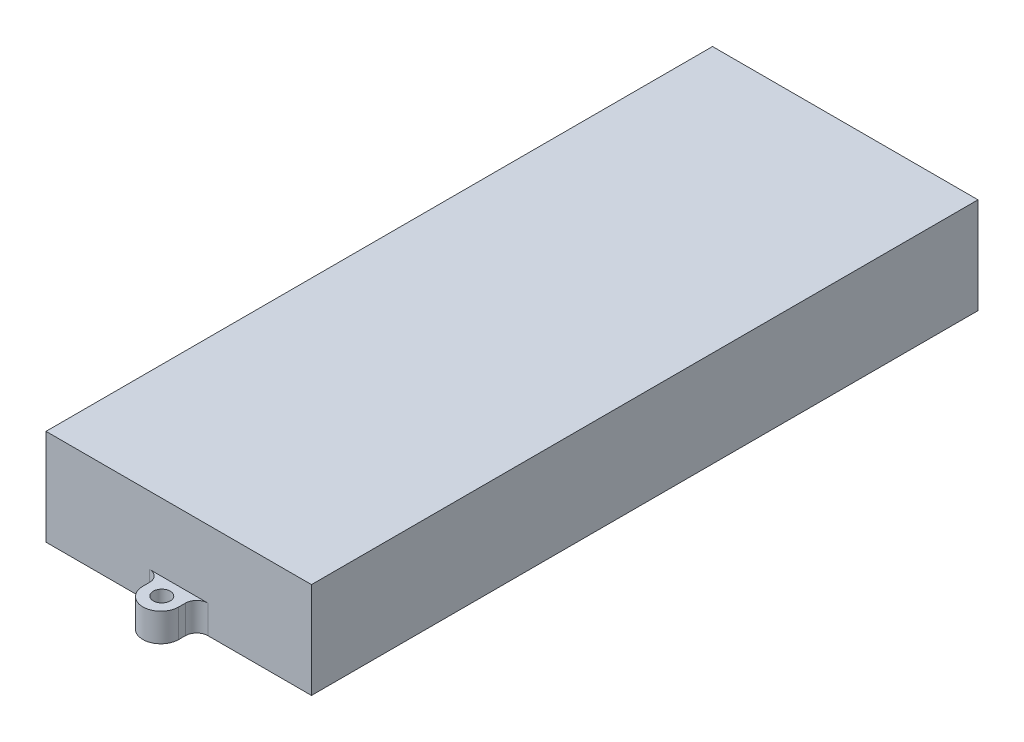
from build123d import *

# Parameters (mm, degrees)
SKETCH1_W           = 47
SKETCH1_H           = 118
BOSS_EXTRUDE1_DEPTH = 17
BOSS_EXTRUDE2_DEPTH = 5
SKETCH3_R           = 1.5
CUT_EXTRUDE1_DEPTH  = 71.476042028
FILLET2_R           = 2


with BuildPart() as part:
    # Sketch1 → Boss-Extrude1 (new body)
    with BuildSketch(Plane(origin=(0, 0, 0), x_dir=(1, 0, 0), z_dir=(0, 1, 0))):
        Rectangle(SKETCH1_W, SKETCH1_H)
    extrude(amount=BOSS_EXTRUDE1_DEPTH)

    # Sketch2 → Boss-Extrude2 (add)
    with BuildSketch(Plane(origin=(0, 0, 0), x_dir=(1, 0, 0), z_dir=(0, 1, 0))):
        with BuildLine():
            Line((-3.175, 62.175), (-3.175, 59))
            Line((-3.175, 59), (3.175, 59))
            Line((3.175, 59), (3.175, 62.175))
            ThreePointArc((3.175, 62.175), (0, 65.35), (-3.175, 62.175))
        make_face()
        with BuildLine():
            Line((3.175, -62.175), (3.175, -59))
            Line((3.175, -59), (-3.175, -59))
            Line((-3.175, -59), (-3.175, -62.175))
            ThreePointArc((-3.175, -62.175), (0, -65.35), (3.175, -62.175))
        make_face()
    extrude(amount=BOSS_EXTRUDE2_DEPTH)

    # Sketch3 → Cut-Extrude1 (cut, through all)
    with BuildSketch(Plane(origin=(0, 5, 0), x_dir=(1, 0, 0), z_dir=(0, 1, 0))):
        with Locations(Location((0, -62, 0), (0, 0, 270))):
            Circle(SKETCH3_R)
        with Locations(Location((0, 62, 0), (0, 0, 270))):
            Circle(SKETCH3_R)
    extrude(amount=-CUT_EXTRUDE1_DEPTH, mode=Mode.SUBTRACT)

    # Fillet2
    fillet2_edges = [part.edges().sort_by_distance(p)[0] for p in [
        (-3.175, 2.5, -59),
        (3.175, 2.5, -59),
        (3.175, 2.5, 59),
        (-3.175, 2.5, 59),
    ]]
    fillet(fillet2_edges, radius=FILLET2_R)


solid = part.part
